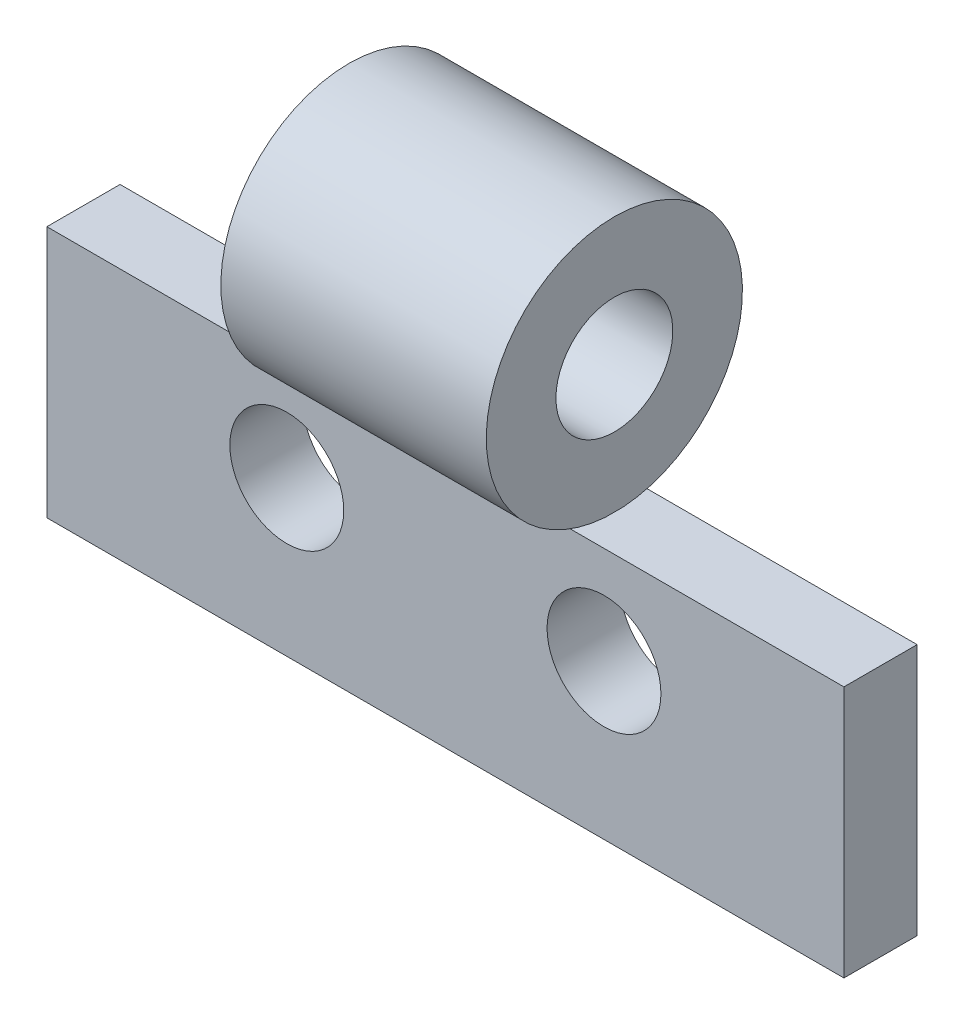
from build123d import *

# Parameters (mm, degrees)
SKETCH1_W           = 24.892
SKETCH1_H           = 7.874
BOSS_EXTRUDE1_DEPTH = 2.286
SKETCH4_R           = 4
BOSS_EXTRUDE3_DEPTH = 16.58
SKETCH5_R           = 1.825
CUT_EXTRUDE2_DEPTH  = 16.58
CUT_EXTRUDE3_DEPTH  = 8.29
SKETCH8_R           = 1.778
CUT_EXTRUDE4_DEPTH  = 8.29
SKETCH9_W           = 2.190957137
SKETCH9_H           = 1.309901185
SKETCH9_W_2         = 1.781735984
SKETCH9_H_2         = 0.803323297
CUT_EXTRUDE5_DEPTH  = 8.29


with BuildPart() as part:
    # Sketch1 → Boss-Extrude1 (new body)
    with BuildSketch(Plane.XY):
        with Locations((-11.83196875, 3.65678125)):
            Rectangle(SKETCH1_W, SKETCH1_H)
    extrude(amount=BOSS_EXTRUDE1_DEPTH)

    # Sketch4 → Boss-Extrude3 (add)
    with BuildSketch(Plane.ZY.offset(24.27796875)):
        with Locations((1.143, 11.58378125)):
            Circle(SKETCH4_R)
    extrude(amount=-BOSS_EXTRUDE3_DEPTH)

    # Sketch5 → Cut-Extrude2 (cut)
    with BuildSketch(Plane.ZY.offset(24.27796875)):
        with Locations((1.143, 11.58378125)):
            Circle(SKETCH5_R)
    extrude(amount=-CUT_EXTRUDE2_DEPTH, mode=Mode.SUBTRACT)

    # Sketch7 → Cut-Extrude3 (cut)
    with BuildSketch(Plane.ZY.offset(24.27796875)):
        Polygon((0.43016706, 7.59378125), (-5.580589686, 7.59378125), (-5.580589686, 19.623956734), (9.570834238, 19.623956734), (9.570834238, 7.59378125), align=None)
    extrude(amount=-CUT_EXTRUDE3_DEPTH, mode=Mode.SUBTRACT)

    # Sketch8 → Cut-Extrude4 (cut)
    with BuildSketch(Plane(origin=(0, 0, 0), x_dir=(-1, 0, 0), z_dir=(0, 0, -1))):
        with Locations((6.87896875, 4.54578125)):
            Circle(SKETCH8_R)
        with Locations((16.78496875, 4.54578125)):
            Circle(SKETCH8_R)
    extrude(amount=-CUT_EXTRUDE4_DEPTH, mode=Mode.SUBTRACT)

    # Sketch9 → Cut-Extrude5 (cut)
    with BuildSketch(Plane.ZY.offset(24.27796875)):
        with Locations((3.381478569, 7.915515048)):
            Rectangle(SKETCH9_W, SKETCH9_H)
        with Locations((-0.890867992, 7.662226104)):
            Rectangle(SKETCH9_W_2, SKETCH9_H_2)
    extrude(amount=-CUT_EXTRUDE5_DEPTH, mode=Mode.SUBTRACT)


solid = part.part
